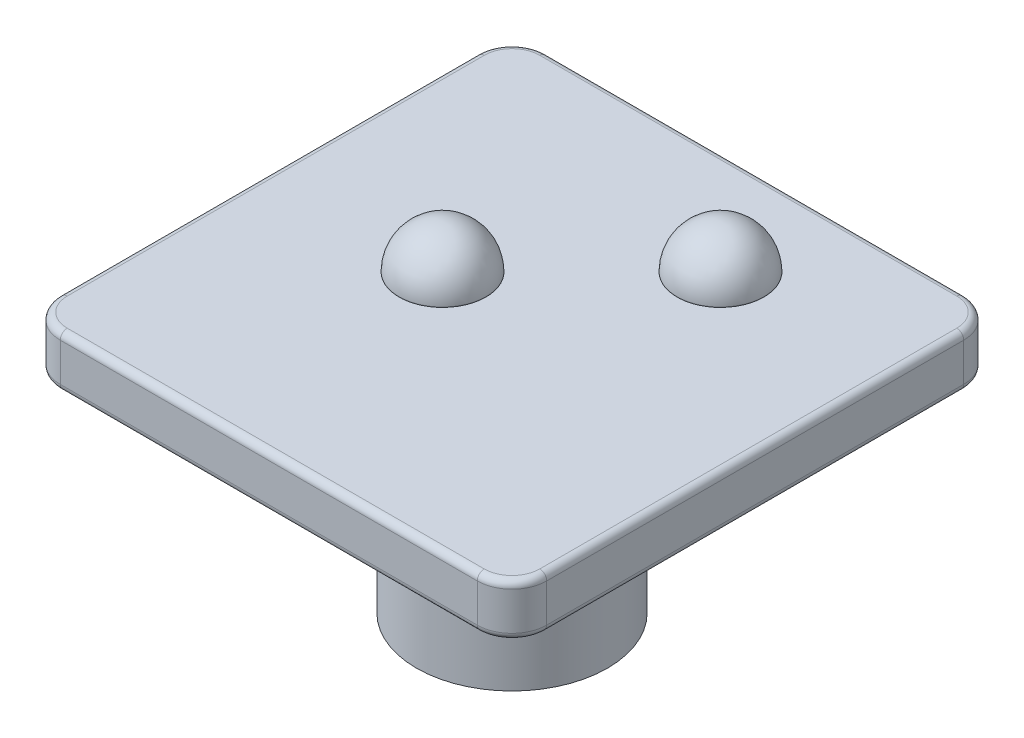
from build123d import *

# Parameters (mm, degrees)
BOSS_EXTRUDE1_DEPTH = 1.5
SKETCH2_R           = 2.75
BOSS_EXTRUDE2_DEPTH = 6
SKETCH3_W           = 1.1
SKETCH3_H           = 1.45
SKETCH3_W_2         = 1.45
SKETCH3_H_2         = 1.1
CUT_EXTRUDE1_DEPTH  = 6
CHAMFER1_SIZE       = 0.3
FILLET1_R           = 1
SKETCH4_R           = 1.25
BOSS_EXTRUDE3_DEPTH = 0.01
DOME2_FACE_RADIUS   = 1.25
DOME2_HEIGHT        = 1.25
DOME3_FACE_RADIUS   = 1.25
DOME3_HEIGHT        = 1.25
FILLET3_R           = 0.2


with BuildPart() as part:
    # Sketch1 → Boss-Extrude1 (new body)
    with BuildSketch(Plane(origin=(0, 0, 0), x_dir=(1, 0, 0), z_dir=(0, 1, 0))):
        with BuildLine():
            Line((-7.324675649, 4.396717546), (4.675324351, 4.396717546))
            ThreePointArc((4.675324351, 4.396717546), (5.382431132, 4.103824327), (5.675324351, 3.396717546))
            Line((5.675324351, 3.396717546), (5.675324351, -8.603282454))
            ThreePointArc((5.675324351, -8.603282454), (5.382431132, -9.310389235), (4.675324351, -9.603282454))
            Line((4.675324351, -9.603282454), (-7.324675649, -9.603282454))
            ThreePointArc((-7.324675649, -9.603282454), (-8.03178243, -9.310389235), (-8.324675649, -8.603282454))
            Line((-8.324675649, -8.603282454), (-8.324675649, 3.396717546))
            ThreePointArc((-8.324675649, 3.396717546), (-8.03178243, 4.103824327), (-7.324675649, 4.396717546))
        make_face()
    extrude(amount=BOSS_EXTRUDE1_DEPTH)

    # Sketch2 → Boss-Extrude2 (add)
    with BuildSketch(Plane.XZ):
        with Locations(Location((-1.324675649, 2.603282454, 0), (0, 0, 270))):
            Circle(SKETCH2_R)
    extrude(amount=BOSS_EXTRUDE2_DEPTH)

    # Sketch3 → Cut-Extrude1 (cut)
    with BuildSketch(Plane.XZ.offset(6)):
        with Locations((-1.324675649, 3.878282454)):
            Rectangle(SKETCH3_W, SKETCH3_H)
        with Locations((-0.049675649, 2.603282454)):
            Rectangle(SKETCH3_W_2, SKETCH3_H_2)
        with Locations((-1.324675649, 2.603282454)):
            Rectangle(SKETCH3_W, SKETCH3_H_2)
        with Locations((-2.599675649, 2.603282454)):
            Rectangle(SKETCH3_W_2, SKETCH3_H_2)
        with Locations((-1.324675649, 1.328282454)):
            Rectangle(SKETCH3_W, SKETCH3_H)
    extrude(amount=-CUT_EXTRUDE1_DEPTH, mode=Mode.SUBTRACT)

    # Chamfer1
    chamfer1_edges = [part.edges().sort_by_distance(p)[0] for p in [
        (-0.774675649, -6, 3.878282454),
        (-0.049675649, -6, 3.153282454),
        (0.675324351, -6, 2.603282454),
        (-0.774675649, -6, 1.328282454),
        (-2.599675649, -6, 3.153282454),
        (-1.324675649, -6, 4.603282454),
        (-1.874675649, -6, 3.878282454),
        (-3.324675649, -6, 2.603282454),
        (-2.599675649, -6, 2.053282454),
        (-1.874675649, -6, 1.328282454),
        (-1.324675649, -6, 0.603282454),
        (-0.049675649, -6, 2.053282454),
    ]]
    chamfer(chamfer1_edges, length=CHAMFER1_SIZE)

    # Fillet1
    fillet1_edges = [part.edges().sort_by_distance(p)[0] for p in [
        (-1.324675649, 0, 5.353282454),
    ]]
    fillet(fillet1_edges, radius=FILLET1_R)

    # Sketch4 → Boss-Extrude3 (add)
    with BuildSketch(Plane(origin=(0, 1.5, 0), x_dir=(1, 0, 0), z_dir=(0, 1, 0))):
        with Locations(Location((-3.324675649, -2.603282454, 0), (0, 0, 90))):
            Circle(SKETCH4_R)
        with Locations(Location((0.675324351, 1.396717546, 0), (0, 0, 90))):
            Circle(SKETCH4_R)
    extrude(amount=BOSS_EXTRUDE3_DEPTH)

    # Dome2: a dome of height H over a round flat face of radius A is a cap of a sphere of radius (A * A + H * H) / (2 * H)
    dome2_r = (DOME2_FACE_RADIUS * DOME2_FACE_RADIUS + DOME2_HEIGHT * DOME2_HEIGHT) / (2 * DOME2_HEIGHT)
    dome2_base = Plane((0.675324351, 1.51, -1.396717546), z_dir=(0, 1, 0))
    with Locations(dome2_base.offset(DOME2_HEIGHT - dome2_r)):
        dome2_ball = Sphere(dome2_r, mode=Mode.PRIVATE)
    add(split(dome2_ball, bisect_by=dome2_base, keep=Keep.TOP, mode=Mode.PRIVATE))

    # Dome3: a dome of height H over a round flat face of radius A is a cap of a sphere of radius (A * A + H * H) / (2 * H)
    dome3_r = (DOME3_FACE_RADIUS * DOME3_FACE_RADIUS + DOME3_HEIGHT * DOME3_HEIGHT) / (2 * DOME3_HEIGHT)
    dome3_base = Plane((-3.324675649, 1.51, 2.603282454), z_dir=(0, 1, 0))
    with Locations(dome3_base.offset(DOME3_HEIGHT - dome3_r)):
        dome3_ball = Sphere(dome3_r, mode=Mode.PRIVATE)
    add(split(dome3_ball, bisect_by=dome3_base, keep=Keep.TOP, mode=Mode.PRIVATE))

    # Fillet3
    fillet3_edges = [part.edges().sort_by_distance(p)[0] for p in [
        (5.382431132, 1.5, 9.310389235),
        (-1.324675649, 0, 9.603282454),
        (-8.03178243, 0, 9.310389235),
        (5.675324351, 1.5, 2.603282454),
        (5.382431132, 1.5, -4.103824327),
        (-1.324675649, 1.5, -4.396717546),
        (-8.03178243, 1.5, -4.103824327),
        (-8.324675649, 1.5, 2.603282454),
        (-8.03178243, 1.5, 9.310389235),
        (-1.324675649, 1.5, 9.603282454),
        (-8.324675649, 0, 2.603282454),
        (-8.03178243, 0, -4.103824327),
        (-1.324675649, 0, -4.396717546),
        (5.382431132, 0, -4.103824327),
        (5.675324351, 0, 2.603282454),
        (5.382431132, 0, 9.310389235),
    ]]
    fillet(fillet3_edges, radius=FILLET3_R)


solid = part.part
